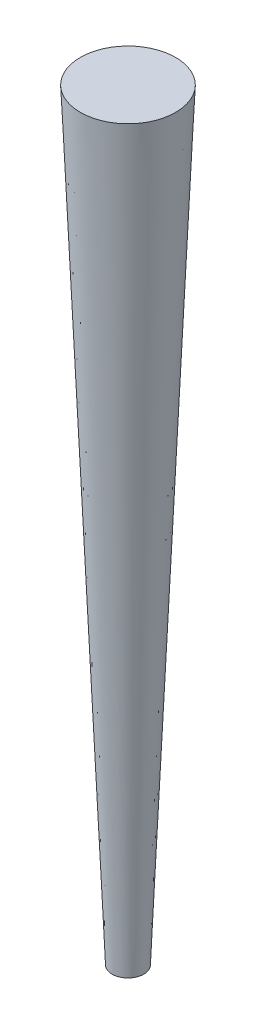
from build123d import *


with BuildPart() as part:
    # Sketch1 → Revolve1 (revolve)
    with BuildSketch(Plane.XY, mode=Mode.PRIVATE) as revolve1_sk:
        Polygon((0, 0), (0, 609.6), (38.1, 609.6), (12.7, 0), align=None)
    revolve(revolve1_sk.sketch.rotate(Axis((0, 127, 0), (0, -1, 0)), 90), axis=Axis((0, 127, 0), (0, -1, 0)))


solid = part.part
